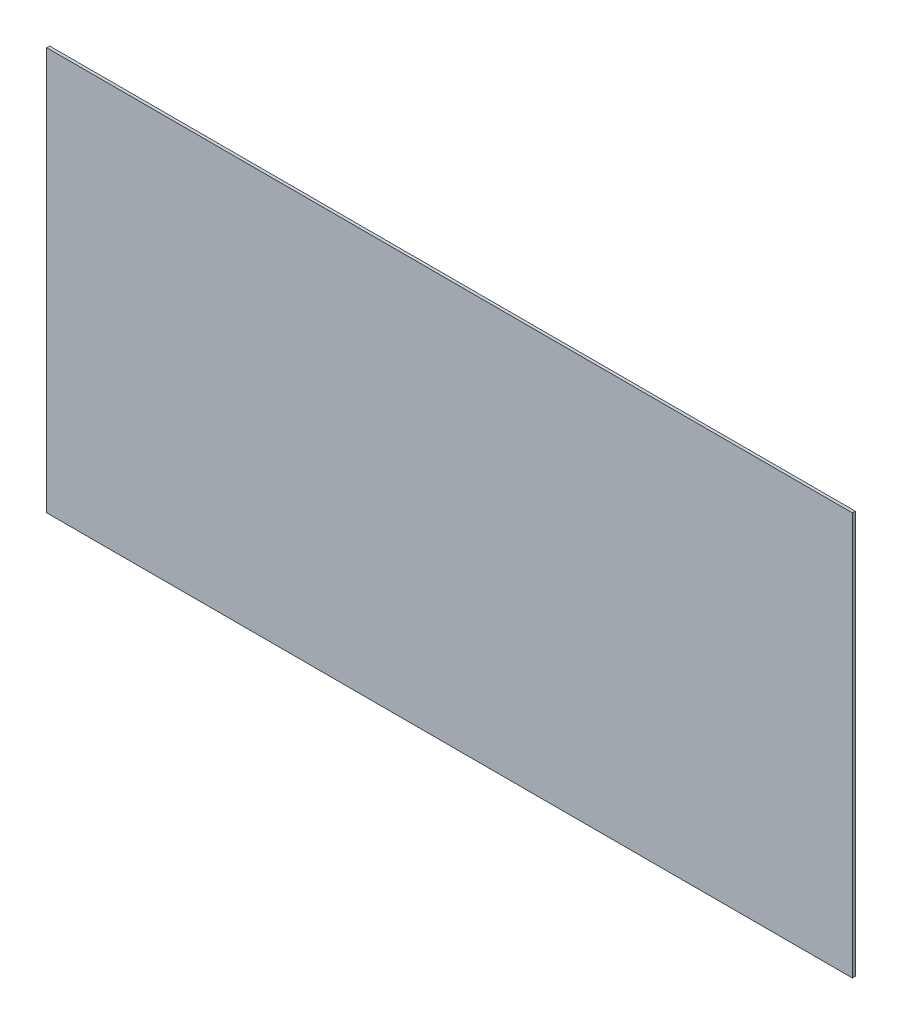
from build123d import *

# Parameters (mm, degrees)
SKETCH_1_W      = 2500
SKETCH_1_H      = 1250
EXTRUDE_1_DEPTH = 9


with BuildPart() as part:
    # Эскиз1 → Бобышка-Вытянуть1 (new body)
    with BuildSketch(Plane.XY):
        with Locations((-1203.578897187, 600.492769744)):
            Rectangle(SKETCH_1_W, SKETCH_1_H)
    extrude(amount=EXTRUDE_1_DEPTH)


solid = part.part
